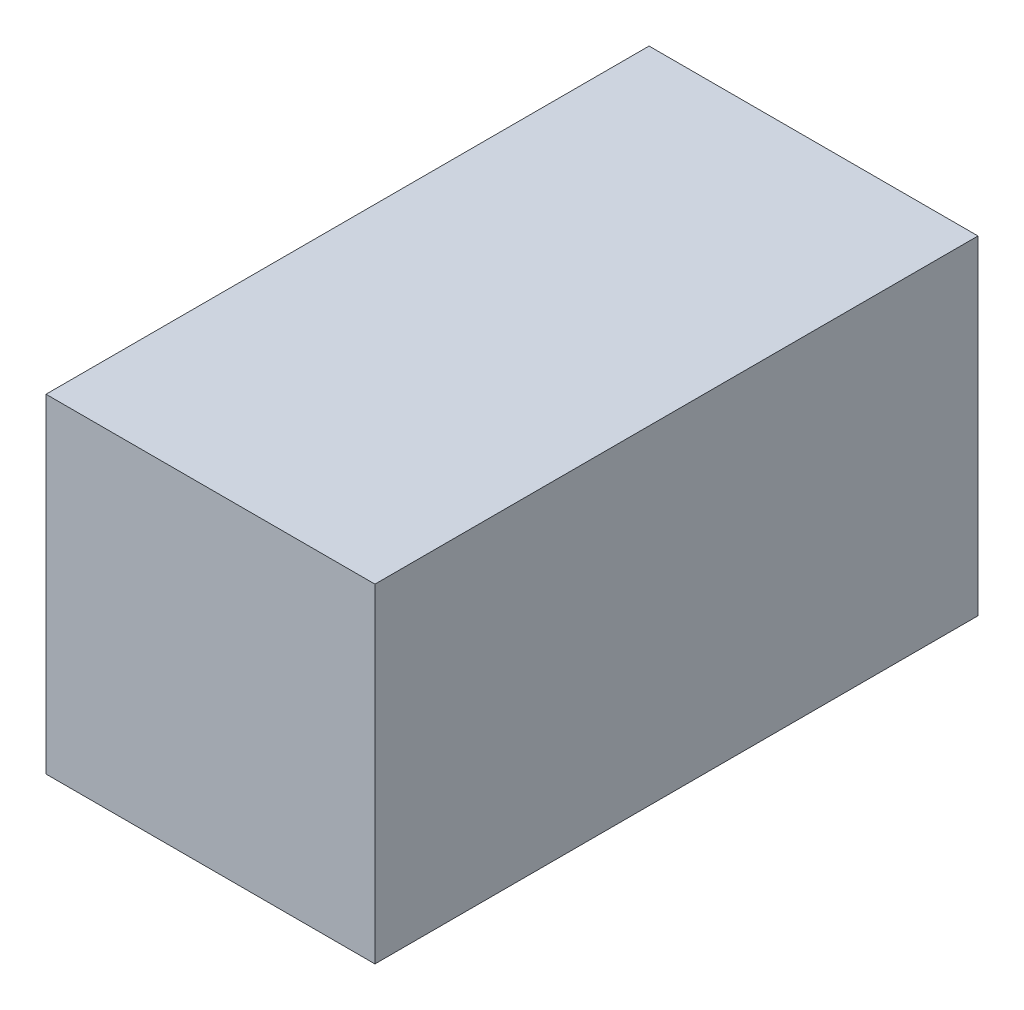
from build123d import *

# Parameters (mm, degrees)
SKETCH1_W           = 76.2
SKETCH1_H           = 76.2
BOSS_EXTRUDE1_DEPTH = 139.7


with BuildPart() as part:
    # Sketch1 → Boss-Extrude1 (new body)
    with BuildSketch(Plane.XY):
        with Locations((38.1, 38.1)):
            Rectangle(SKETCH1_W, SKETCH1_H)
    extrude(amount=BOSS_EXTRUDE1_DEPTH)


solid = part.part
